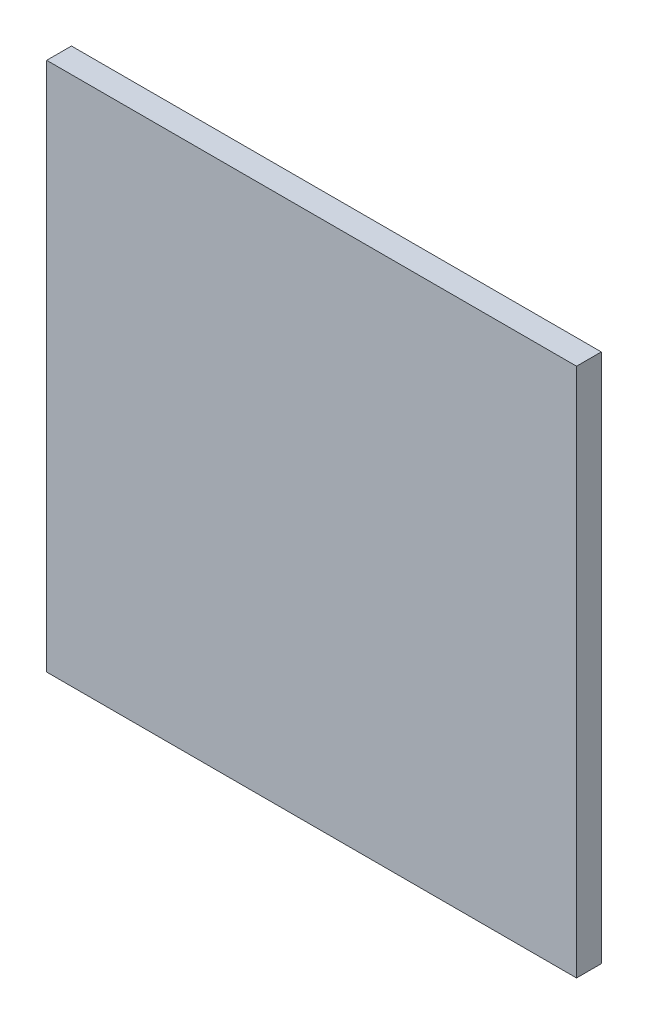
from build123d import *

# Parameters (mm, degrees)
SKETCH1_W           = 535
SKETCH1_H           = 535
BOSS_EXTRUDE1_DEPTH = 25


with BuildPart() as part:
    # Sketch1 → Boss-Extrude1 (new body)
    with BuildSketch(Plane.XY):
        Rectangle(SKETCH1_W, SKETCH1_H)
    extrude(amount=BOSS_EXTRUDE1_DEPTH)


solid = part.part
